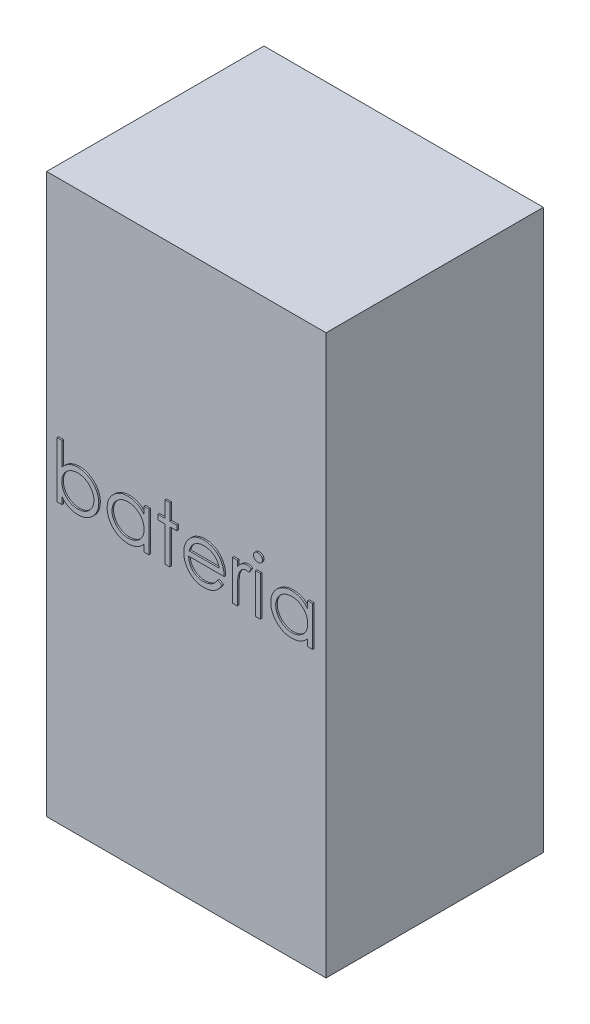
from build123d import *

# Parameters (mm, degrees)
SKETCH1_W           = 18
SKETCH1_H           = 36
BOSS_EXTRUDE1_DEPTH = 14
SKETCH2_W           = 0.314102565
SKETCH2_H           = 2.557692308
BOSS_EXTRUDE2_DEPTH = 0.1


with BuildPart() as part:
    # Sketch1 → Boss-Extrude1 (new body)
    with BuildSketch(Plane.XY):
        with Locations((9, -18)):
            Rectangle(SKETCH1_W, SKETCH1_H)
    extrude(amount=BOSS_EXTRUDE1_DEPTH)

    # Sketch2 → Boss-Extrude2 (add)
    # profile 1 of 8: a face of its own
    with BuildSketch(Plane.XY.offset(14)):
        with BuildLine():
            Line((0.766025641, -18), (0.766025641, -14.41025641))
            Line((0.766025641, -14.41025641), (1.080128205, -14.41025641))
            Line((1.080128205, -14.41025641), (1.080128205, -15.906450321))
            add(Edge.make_bspline(
                [(1.080128205, -15.906450321), (1.115521624, -15.865692389), (1.184575644, -15.786171983), (1.300352095, -15.682324334), (1.421757664, -15.594271856), (1.54971592, -15.521685738), (1.684408853, -15.466412131), (1.825140962, -15.425989741), (1.972272003, -15.401602838), (2.072591177, -15.398836765), (2.123397436, -15.397435897)],
                knots=[0, 0, 0, 0, 1.077089805, 2.101446609, 3.097517232, 4.067117542, 5.031729543, 5.997785507, 6.985986182, 8, 8, 8, 8], degree=3))
            add(Edge.make_bspline(
                [(2.123397436, -15.397435897), (2.168563574, -15.398676126), (2.257864726, -15.401128268), (2.389146873, -15.419762763), (2.515460148, -15.449980565), (2.636735796, -15.491872745), (2.752407928, -15.547455722), (2.863466985, -15.61399703), (2.96934397, -15.693235359), (3.068398855, -15.78383367), (3.159692742, -15.882190292), (3.239605252, -15.987370608), (3.307104948, -16.097845698), (3.36293624, -16.213245761), (3.406107293, -16.334042112), (3.435849561, -16.46011631), (3.454743025, -16.591344329), (3.457123271, -16.680657132), (3.458333333, -16.726061699)],
                knots=[0, 0, 0, 0, 1.034377878, 2.045141349, 3.03070803, 4.00595497, 4.978199603, 5.965204761, 6.967410914, 8.002051993, 9.036360596, 10.037508045, 11.022711142, 11.997267194, 12.969246472, 13.954813154, 14.960274251, 16, 16, 16, 16], degree=3))
            add(Edge.make_bspline(
                [(3.458333333, -16.726061699), (3.457096893, -16.770761716), (3.454658827, -16.858903112), (3.436037519, -16.988609668), (3.405291254, -17.113448367), (3.361330071, -17.233096624), (3.306065132, -17.348116538), (3.236953856, -17.457196942), (3.157142857, -17.562235918), (3.064811708, -17.659859549), (2.964898155, -17.750092949), (2.857983913, -17.828498814), (2.746761991, -17.896215934), (2.629498879, -17.949871382), (2.507930837, -17.993272303), (2.38075545, -18.023389994), (2.248692222, -18.040963049), (2.158973334, -18.043558616), (2.113581731, -18.044871795)],
                knots=[0, 0, 0, 0, 1.024244038, 2.01964794, 2.996620209, 3.965911562, 4.936179293, 5.91563013, 6.920572822, 7.955171681, 8.990768464, 10.002129126, 10.989675881, 11.969873457, 12.952483066, 13.943799762, 14.959703725, 16, 16, 16, 16], degree=3))
            add(Edge.make_bspline(
                [(2.113581731, -18.044871795), (2.061616619, -18.043431187), (1.959722094, -18.040606405), (1.810669429, -18.017187426), (1.669587879, -17.977325816), (1.534870331, -17.92376406), (1.408442608, -17.851235406), (1.289502026, -17.761278656), (1.178798653, -17.652411519), (1.113581838, -17.569350029), (1.080128205, -17.526742788)],
                knots=[0, 0, 0, 0, 1.035807596, 2.031038093, 2.998900396, 3.954262848, 4.914341711, 5.895762244, 6.92060972, 8, 8, 8, 8], degree=3))
            Line((1.080128205, -17.526742788), (1.080128205, -18))
            Line((1.080128205, -18), (0.766025641, -18))
        make_face()
        with BuildLine():
            add(Edge.make_bspline(
                [(2.110777244, -17.730769231), (2.156691596, -17.729135602), (2.247319225, -17.725911078), (2.380363015, -17.700737455), (2.507677225, -17.658853341), (2.628620307, -17.601569633), (2.741299619, -17.529547598), (2.841952253, -17.442401428), (2.931431963, -17.342899913), (3.006083739, -17.23066622), (3.068409983, -17.111215251), (3.111223259, -16.985560949), (3.139942981, -16.85706616), (3.142795279, -16.769920116), (3.144230769, -16.726061699)],
                knots=[0, 0, 0, 0, 1.031910345, 2.036826888, 3.032245421, 4.038315463, 5.03827337, 6.029480047, 7.023177075, 8.037597977, 9.052889626, 10.043399556, 11.015292101, 12, 12, 12, 12], degree=3))
            add(Edge.make_bspline(
                [(3.144230769, -16.726061699), (3.142343025, -16.682246157), (3.138575074, -16.594789996), (3.112200291, -16.465140329), (3.066142501, -16.339552704), (3.005024478, -16.218374716), (2.929156493, -16.105366915), (2.840150529, -16.003876788), (2.738268723, -15.916316804), (2.625445304, -15.843326733), (2.505265113, -15.78376718), (2.37877448, -15.742922154), (2.248616357, -15.716183967), (2.160220864, -15.713094838), (2.115685096, -15.711538462)],
                knots=[0, 0, 0, 0, 0.984795267, 1.965658976, 2.959410029, 3.983795688, 5.009594896, 6.01088574, 7.009236619, 8.019050059, 9.024672985, 10.014834719, 10.999826153, 12, 12, 12, 12], degree=3))
            add(Edge.make_bspline(
                [(2.115685096, -15.711538462), (2.070217589, -15.713093959), (1.979973812, -15.716181306), (1.84680559, -15.74296913), (1.716742306, -15.784016741), (1.592454774, -15.842948091), (1.476600719, -15.915059551), (1.372988107, -15.999799751), (1.283656549, -16.096579659), (1.210112778, -16.20508546), (1.151707979, -16.322270496), (1.109924231, -16.447282699), (1.084924585, -16.579464012), (1.081746452, -16.670097217), (1.080128205, -16.716245994)],
                knots=[0, 0, 0, 0, 1.016820015, 2.018181405, 3.029022337, 4.06341356, 5.088169224, 6.076823655, 7.05054209, 8.02560866, 9.001194327, 9.972267242, 10.967515442, 12, 12, 12, 12], degree=3))
            add(Edge.make_bspline(
                [(1.080128205, -16.716245994), (1.081087876, -16.751583812), (1.082976811, -16.821139821), (1.097407179, -16.923267512), (1.120362841, -17.021000604), (1.152706335, -17.1144456), (1.19520757, -17.20307204), (1.246417835, -17.28756812), (1.307369482, -17.367171398), (1.376276071, -17.441686718), (1.452238452, -17.509496133), (1.533761571, -17.568274358), (1.619179501, -17.618888548), (1.709469472, -17.65923339), (1.803580763, -17.692159911), (1.902479104, -17.713893657), (2.005150528, -17.728868696), (2.075197625, -17.730129049), (2.110777244, -17.730769231)],
                knots=[0, 0, 0, 0, 1.050331198, 2.067384183, 3.060053655, 4.031335885, 5.001026174, 5.976994447, 6.963687968, 7.976578778, 8.990422448, 9.985569286, 10.960374351, 11.936812464, 12.921228065, 13.919088064, 14.943024695, 16, 16, 16, 16], degree=3))
        make_face(mode=Mode.SUBTRACT)
    # profile 2 of 8: a face of its own
    with BuildSketch(Plane.XY.offset(14)):
        with BuildLine():
            Line((6.689102564, -15.442307692), (6.689102564, -18))
            Line((6.689102564, -18), (6.375, -18))
            Line((6.375, -18), (6.375, -17.557592147))
            add(Edge.make_bspline(
                [(6.375, -17.557592147), (6.339581209, -17.597631741), (6.270460994, -17.675769512), (6.155019876, -17.777851685), (6.032651698, -17.862230007), (5.903950377, -17.930379922), (5.769032134, -17.981571979), (5.628196046, -18.017958138), (5.481384666, -18.041351973), (5.381132311, -18.043687995), (5.330328526, -18.044871795)],
                knots=[0, 0, 0, 0, 1.074387032, 2.096679803, 3.090159297, 4.057316773, 5.018401886, 5.985159533, 6.978961417, 8, 8, 8, 8], degree=3))
            add(Edge.make_bspline(
                [(5.330328526, -18.044871795), (5.285160572, -18.043645423), (5.196087367, -18.041226962), (5.06505829, -18.022464659), (4.93896604, -17.992334037), (4.817691468, -17.950433147), (4.702019322, -17.894852326), (4.590959226, -17.828311078), (4.485086534, -17.749070248), (4.386014995, -17.658482219), (4.294782994, -17.560087232), (4.214721722, -17.455141685), (4.147968642, -17.344099381), (4.092148561, -17.228366227), (4.049152217, -17.107051308), (4.019178582, -16.98057414), (4.000438136, -16.849084266), (3.998020675, -16.759544743), (3.996794872, -16.714142628)],
                knots=[0, 0, 0, 0, 1.033919861, 2.038935746, 3.024066025, 3.998881131, 4.97069526, 5.957263378, 6.95902576, 7.993208707, 9.027059324, 10.027763471, 11.009749337, 11.988697705, 12.965288445, 13.950418724, 14.960734635, 16, 16, 16, 16], degree=3))
            add(Edge.make_bspline(
                [(3.996794872, -16.714142628), (3.998047843, -16.669678925), (4.0005249, -16.581776581), (4.01897812, -16.452497883), (4.050009129, -16.327979623), (4.093556976, -16.208622679), (4.149398931, -16.094282629), (4.217327018, -15.984878604), (4.297346143, -15.880109207), (4.38959855, -15.78243798), (4.48953332, -15.692217366), (4.596442051, -15.61380832), (4.707665332, -15.546091471), (4.824928343, -15.492437995), (4.946495448, -15.449028891), (5.073448893, -15.418995922), (5.205260472, -15.401298601), (5.294750964, -15.398735837), (5.340144231, -15.397435897)],
                knots=[0, 0, 0, 0, 1.020392517, 2.01726096, 2.990465484, 3.961182959, 4.928053699, 5.906110375, 6.912531644, 7.948652711, 8.985773172, 9.998621852, 10.987621588, 11.969261332, 12.953316658, 13.946091881, 14.958173133, 16, 16, 16, 16], degree=3))
            add(Edge.make_bspline(
                [(5.340144231, -15.397435897), (5.39234409, -15.398873649), (5.49470555, -15.401693012), (5.644433559, -15.425155739), (5.786078037, -15.464794206), (5.920732389, -15.518711704), (6.047913075, -15.590360433), (6.166416059, -15.680740394), (6.277481543, -15.789281581), (6.341861834, -15.872652026), (6.375, -15.915564904)],
                knots=[0, 0, 0, 0, 1.038897134, 2.037228247, 3.008116434, 3.962042015, 4.918381754, 5.904844433, 6.921570401, 8, 8, 8, 8], degree=3))
            Line((6.375, -15.915564904), (6.375, -15.442307692))
            Line((6.375, -15.442307692), (6.689102564, -15.442307692))
        make_face()
        with BuildLine():
            add(Edge.make_bspline(
                [(5.344350962, -15.711538462), (5.298436624, -15.713172099), (5.207809024, -15.71639664), (5.074765022, -15.741570135), (4.947451608, -15.78345473), (4.826505533, -15.840736631), (4.713837317, -15.912765368), (4.613143646, -15.999886751), (4.523600944, -16.099723765), (4.44829268, -16.211825875), (4.386902183, -16.332003967), (4.343735151, -16.457628405), (4.315265904, -16.586433382), (4.312357383, -16.673796068), (4.310897436, -16.717648237)],
                knots=[0, 0, 0, 0, 1.031046209, 2.035121221, 3.029706178, 4.034933723, 5.034054252, 6.02443088, 7.017295772, 8.038157696, 9.050218397, 10.03989886, 11.016116709, 12, 12, 12, 12], degree=3))
            add(Edge.make_bspline(
                [(4.310897436, -16.717648237), (4.312762329, -16.761238344), (4.316484806, -16.8482477), (4.3432355, -16.977228277), (4.388115374, -17.102882319), (4.449357437, -17.224143313), (4.526044061, -17.336727413), (4.614932714, -17.438467536), (4.716882995, -17.525957124), (4.829810502, -17.599194697), (4.950418473, -17.658357218), (5.077252404, -17.699522858), (5.207928042, -17.726100638), (5.296780376, -17.729205115), (5.341546474, -17.730769231)],
                knots=[0, 0, 0, 0, 0.979072187, 1.954306742, 2.945804271, 3.96968567, 4.997920485, 5.998718438, 6.996577872, 8.005894225, 9.015743152, 10.005417472, 10.995077863, 12, 12, 12, 12], degree=3))
            add(Edge.make_bspline(
                [(5.341546474, -17.730769231), (5.386992977, -17.729109267), (5.477381564, -17.725807763), (5.610820272, -17.700526498), (5.740315234, -17.6587577), (5.864102463, -17.600858573), (5.979418594, -17.529101217), (6.082916471, -17.445094126), (6.17043244, -17.347390942), (6.244625049, -17.240014489), (6.302800466, -17.122302492), (6.345176525, -16.996968302), (6.370230431, -16.864007553), (6.373388161, -16.773143626), (6.375, -16.726762821)],
                knots=[0, 0, 0, 0, 1.01762866, 2.023962475, 3.030623092, 4.058876274, 5.077231937, 6.066672613, 7.034107872, 8.005628644, 8.981990164, 9.965428785, 10.961468474, 12, 12, 12, 12], degree=3))
            add(Edge.make_bspline(
                [(6.375, -16.726762821), (6.374040344, -16.69142499), (6.372151436, -16.621868957), (6.357720867, -16.519741439), (6.33476594, -16.422007713), (6.30241977, -16.328565024), (6.259928486, -16.239930009), (6.20868072, -16.155466248), (6.14777527, -16.075613037), (6.078192574, -16.001469966), (6.002027372, -15.933843504), (5.921432831, -15.873479263), (5.835454084, -15.82389049), (5.745537047, -15.782849219), (5.651525713, -15.750190069), (5.552655093, -15.728402375), (5.449976106, -15.713442054), (5.37993005, -15.712179673), (5.344350962, -15.711538462)],
                knots=[0, 0, 0, 0, 1.050140795, 2.067009409, 3.05949893, 4.030605086, 5.00011959, 5.97591094, 6.962425594, 7.979863591, 8.993523472, 9.986985069, 10.967611495, 11.937549037, 12.921786183, 13.919465291, 14.943216303, 16, 16, 16, 16], degree=3))
        make_face(mode=Mode.SUBTRACT)
    # profile 3 of 8: a face of its own
    with BuildSketch(Plane.XY.offset(14)):
        Polygon((7.721153846, -14.41025641), (8.03525641, -14.41025641), (8.03525641, -15.442307692), (8.483974359, -15.442307692), (8.483974359, -15.756410256), (8.03525641, -15.756410256), (8.03525641, -18), (7.721153846, -18), (7.721153846, -15.756410256), (7.272435897, -15.756410256), (7.272435897, -15.442307692), (7.721153846, -15.442307692), align=None)
    # profile 4 of 8: a face of its own
    with BuildSketch(Plane.XY.offset(14)):
        with BuildLine():
            Line((11.121594551, -17.192307692), (11.400641026, -17.338842147))
            add(Edge.make_bspline(
                [(11.400641026, -17.338842147), (11.37840443, -17.378285479), (11.335140822, -17.455026582), (11.260740074, -17.560458442), (11.182748001, -17.655306158), (11.097644033, -17.737035812), (11.007974354, -17.808287197), (10.9132417, -17.870625022), (10.812952882, -17.923743542), (10.707103157, -17.96849607), (10.594803606, -18.002905564), (10.47578209, -18.027209785), (10.349810594, -18.042233054), (10.263464414, -18.043978194), (10.219250801, -18.044871795)],
                knots=[0, 0, 0, 0, 1.120438281, 2.179929193, 3.190490725, 4.156257408, 5.095198341, 6.022838206, 6.959905092, 7.901321166, 8.864066838, 9.862729781, 10.905609505, 12, 12, 12, 12], degree=3))
            add(Edge.make_bspline(
                [(10.219250801, -18.044871795), (10.170108824, -18.04372462), (10.074247062, -18.041486813), (9.934707315, -18.022194348), (9.803327897, -17.99072199), (9.680116193, -17.946756448), (9.565373941, -17.889329124), (9.458873086, -17.819369642), (9.36005356, -17.737237388), (9.272029351, -17.642220944), (9.192785468, -17.540538987), (9.122859648, -17.434583102), (9.064402217, -17.324619878), (9.016849607, -17.211349354), (8.978444742, -17.09548546), (8.951678038, -16.975973993), (8.93624829, -16.853138408), (8.933883845, -16.770041073), (8.932692308, -16.728165064)],
                knots=[0, 0, 0, 0, 1.145258523, 2.234067595, 3.276747158, 4.290159414, 5.277019952, 6.260822364, 7.254936242, 8.264827045, 9.274100331, 10.257902744, 11.220704747, 12.172965371, 13.118907548, 14.062713208, 15.023725156, 16, 16, 16, 16], degree=3))
            add(Edge.make_bspline(
                [(8.932692308, -16.728165064), (8.933751449, -16.688870234), (8.935850527, -16.610993069), (8.949081315, -16.495727524), (8.972529608, -16.383699072), (9.004705932, -16.274814624), (9.046257178, -16.16925649), (9.097089397, -16.066960426), (9.157281775, -15.968035287), (9.203754449, -15.905632153), (9.227163462, -15.874198718)],
                knots=[0, 0, 0, 0, 1.024358464, 2.0301432, 3.019427413, 4.004406732, 4.986367066, 5.972626655, 6.978780325, 8, 8, 8, 8], degree=3))
            add(Edge.make_bspline(
                [(9.227163462, -15.874198718), (9.258871144, -15.836329848), (9.321282091, -15.761791697), (9.426838446, -15.663853372), (9.541138643, -15.581809596), (9.662750269, -15.51380246), (9.793086743, -15.462128813), (9.930396034, -15.423621231), (10.07624162, -15.40204322), (10.175946841, -15.398995386), (10.226963141, -15.397435897)],
                knots=[0, 0, 0, 0, 1.030682036, 2.02871468, 2.997146059, 3.962720338, 4.930598197, 5.918074684, 6.934738563, 8, 8, 8, 8], degree=3))
            add(Edge.make_bspline(
                [(10.226963141, -15.397435897), (10.279410746, -15.398789946), (10.382300992, -15.401446282), (10.532333113, -15.426072615), (10.67429383, -15.46512517), (10.808126334, -15.52027896), (10.933844195, -15.591438512), (11.050630244, -15.679580353), (11.160481757, -15.781998441), (11.224390336, -15.86076165), (11.256911058, -15.900841346)],
                knots=[0, 0, 0, 0, 1.056321875, 2.072262726, 3.055038591, 4.01806755, 4.982017516, 5.957941055, 6.960871419, 8, 8, 8, 8], degree=3))
            add(Edge.make_bspline(
                [(11.256911058, -15.900841346), (11.279037996, -15.931044928), (11.323144589, -15.991251046), (11.378391689, -16.089422203), (11.426349084, -16.192132798), (11.464682045, -16.301043095), (11.495721546, -16.414862675), (11.518178365, -16.53440522), (11.531347984, -16.659635131), (11.533936681, -16.744961686), (11.53525641, -16.788461538)],
                knots=[0, 0, 0, 0, 0.94817472, 1.890038105, 2.849395472, 3.817997239, 4.812318967, 5.836947057, 6.897266129, 8, 8, 8, 8], degree=3))
            Line((11.53525641, -16.788461538), (9.246794872, -16.788461538))
            add(Edge.make_bspline(
                [(9.246794872, -16.788461538), (9.248334478, -16.822162003), (9.251362052, -16.888432606), (9.265477195, -16.98540339), (9.287725969, -17.077776732), (9.318995032, -17.164859774), (9.356861877, -17.247789901), (9.403247594, -17.325951938), (9.458587148, -17.398989868), (9.520312847, -17.467557006), (9.589019942, -17.528617767), (9.66130269, -17.583269543), (9.738196255, -17.62907514), (9.819094338, -17.66625503), (9.903866123, -17.695361346), (9.992538318, -17.715229166), (10.084936435, -17.728536273), (10.147922169, -17.730015939), (10.179987981, -17.730769231)],
                knots=[0, 0, 0, 0, 1.094153842, 2.151609401, 3.174256925, 4.172055639, 5.149267565, 6.128595816, 7.11444997, 8.118368179, 9.117203808, 10.09244225, 11.054858984, 12.015122123, 12.976791628, 13.957293641, 14.960065497, 16, 16, 16, 16], degree=3))
            add(Edge.make_bspline(
                [(10.179987981, -17.730769231), (10.211339128, -17.730161174), (10.273545819, -17.728954673), (10.366186677, -17.717222762), (10.457326204, -17.698252487), (10.546587187, -17.672362496), (10.632158033, -17.640785644), (10.711403583, -17.602682787), (10.784283799, -17.56053304), (10.852400766, -17.512323365), (10.918471759, -17.453315178), (10.984014245, -17.379679457), (11.054290899, -17.292591929), (11.098280491, -17.227046263), (11.121594551, -17.192307692)],
                knots=[0, 0, 0, 0, 0.99110716, 1.966546729, 2.947904876, 3.932708344, 4.903319531, 5.828989031, 6.710028674, 7.56322171, 8.463672341, 9.504779593, 10.677557249, 12, 12, 12, 12], degree=3))
        make_face()
        with BuildLine():
            add(Edge.make_bspline(
                [(11.221153846, -16.474358974), (11.209657222, -16.432696101), (11.18752992, -16.35250848), (11.141293556, -16.24146759), (11.089222015, -16.142779689), (11.027600284, -16.057200056), (10.957781558, -15.981196543), (10.877136375, -15.914777957), (10.786700482, -15.855360506), (10.686941341, -15.805208007), (10.581299556, -15.762518148), (10.470693364, -15.733893032), (10.357835576, -15.71428349), (10.28150129, -15.712457382), (10.243088942, -15.711538462)],
                knots=[0, 0, 0, 0, 1.154881502, 2.222775134, 3.210006277, 4.132804581, 5.035138423, 5.962687519, 6.919655026, 7.923214229, 8.944639381, 9.960483929, 10.97369054, 12, 12, 12, 12], degree=3))
            add(Edge.make_bspline(
                [(10.243088942, -15.711538462), (10.211739504, -15.712150133), (10.149768255, -15.713359279), (10.058467187, -15.724829408), (9.970787488, -15.743789253), (9.8860822, -15.76975421), (9.805461332, -15.804362812), (9.727266563, -15.844946039), (9.653486167, -15.894487623), (9.607344872, -15.932246478), (9.584034455, -15.951322115)],
                knots=[0, 0, 0, 0, 1.04873581, 2.073130211, 3.073294108, 4.04793562, 5.032784715, 6.005352987, 6.992311501, 8, 8, 8, 8], degree=3))
            add(Edge.make_bspline(
                [(9.584034455, -15.951322115), (9.567341173, -15.966416431), (9.533558039, -15.996963647), (9.488417517, -16.049592854), (9.445197045, -16.106344416), (9.405863392, -16.16938954), (9.369785806, -16.238010319), (9.336025828, -16.311627955), (9.305639416, -16.390801085), (9.288543306, -16.445973524), (9.279747596, -16.474358974)],
                knots=[0, 0, 0, 0, 0.879870761, 1.780643979, 2.707998968, 3.669668524, 4.684282772, 5.740141944, 6.837334558, 8, 8, 8, 8], degree=3))
            Line((9.279747596, -16.474358974), (11.221153846, -16.474358974))
        make_face(mode=Mode.SUBTRACT)
    # profile 5 of 8: a face of its own
    with BuildSketch(Plane.XY.offset(14)):
        with BuildLine():
            Line((12.073717949, -15.442307692), (12.387820513, -15.442307692))
            Line((12.387820513, -15.442307692), (12.387820513, -15.818810096))
            add(Edge.make_bspline(
                [(12.387820513, -15.818810096), (12.411009272, -15.783754268), (12.455357593, -15.716710269), (12.529070522, -15.628040968), (12.604573853, -15.554625921), (12.68222904, -15.496122402), (12.76260714, -15.452309283), (12.843944092, -15.420216248), (12.927519562, -15.401238933), (12.983681486, -15.398705274), (13.01181891, -15.397435897)],
                knots=[0, 0, 0, 0, 1.2804753, 2.448899062, 3.506932113, 4.484331642, 5.4025378, 6.288909075, 7.142734305, 8, 8, 8, 8], degree=3))
            add(Edge.make_bspline(
                [(13.01181891, -15.397435897), (13.033645237, -15.398626424), (13.078554322, -15.40107601), (13.146536912, -15.418286835), (13.216580364, -15.445764857), (13.261722751, -15.47160508), (13.28525641, -15.485076122)],
                knots=[0, 0, 0, 0, 0.901110191, 1.854092781, 2.881294221, 4, 4, 4, 4], degree=3))
            Line((13.28525641, -15.485076122), (13.112780449, -15.757111378))
            add(Edge.make_bspline(
                [(13.112780449, -15.757111378), (13.097671428, -15.750371112), (13.068991613, -15.737576797), (13.027037047, -15.722434787), (12.98835571, -15.713518871), (12.963712152, -15.712168153), (12.952223558, -15.711538462)],
                knots=[0, 0, 0, 0, 1.180555205, 2.24091978, 3.179933427, 4, 4, 4, 4], degree=3))
            add(Edge.make_bspline(
                [(12.952223558, -15.711538462), (12.927017824, -15.713218499), (12.875605434, -15.716645288), (12.800120935, -15.743584096), (12.726873729, -15.787109336), (12.668702067, -15.835380448), (12.623659814, -15.881928245), (12.591519589, -15.922576648), (12.562036842, -15.968155279), (12.533866621, -16.017884963), (12.508200327, -16.072614809), (12.484245658, -16.131798023), (12.462586795, -16.195503151), (12.450236551, -16.239885672), (12.443910256, -16.262620192)],
                knots=[0, 0, 0, 0, 1.125678352, 2.296057538, 3.5422874, 4.923748041, 5.663163013, 6.437101912, 7.23742474, 8.08941207, 8.991984279, 9.93940061, 10.944477711, 12, 12, 12, 12], degree=3))
            add(Edge.make_bspline(
                [(12.443910256, -16.262620192), (12.439177863, -16.282897366), (12.428695971, -16.327809765), (12.418504434, -16.403158289), (12.408434916, -16.492181948), (12.401338297, -16.595128541), (12.394760255, -16.711740985), (12.391050173, -16.84219693), (12.387947032, -16.986630282), (12.387863965, -17.087604635), (12.387820513, -17.140424679)],
                knots=[0, 0, 0, 0, 0.566838948, 1.255505196, 2.06880316, 3.007127437, 4.065329342, 5.249902469, 6.561414163, 8, 8, 8, 8], degree=3))
            Line((12.387820513, -17.140424679), (12.387820513, -18))
            Line((12.387820513, -18), (12.073717949, -18))
            Line((12.073717949, -18), (12.073717949, -15.442307692))
        make_face()
    # profile 6 of 8: a face of its own
    with BuildSketch(Plane.XY.offset(14)):
        with BuildLine():
            add(Edge.make_bspline(
                [(13.710136218, -14.365384615), (13.729627534, -14.366288768), (13.767795274, -14.368059272), (13.822988541, -14.383220749), (13.873245553, -14.408920434), (13.917823286, -14.443400115), (13.956075173, -14.483949559), (13.982855883, -14.531210527), (14.000068279, -14.582269166), (14.002146835, -14.617884255), (14.003205128, -14.636017628)],
                knots=[0, 0, 0, 0, 1.055194115, 2.066272739, 3.074728998, 4.095836921, 5.109056067, 6.073838105, 7.019297344, 8, 8, 8, 8], degree=3))
            add(Edge.make_bspline(
                [(14.003205128, -14.636017628), (14.002122968, -14.653680281), (13.999983666, -14.688597256), (13.982869178, -14.738770728), (13.95584694, -14.785375012), (13.917847815, -14.825845722), (13.873239054, -14.860306342), (13.822990268, -14.886011081), (13.767794819, -14.901171218), (13.72962738, -14.902941907), (13.710136218, -14.903846154)],
                knots=[0, 0, 0, 0, 0.96129708, 1.900370562, 2.859976407, 3.87933698, 4.906634145, 5.921202961, 6.938410037, 8, 8, 8, 8], degree=3))
            add(Edge.make_bspline(
                [(13.710136218, -14.903846154), (13.690867943, -14.902976434), (13.653364763, -14.901283637), (13.59899792, -14.885713619), (13.549169431, -14.860297546), (13.504504758, -14.826071361), (13.467274565, -14.785126464), (13.44017624, -14.73879917), (13.423101278, -14.688590015), (13.420956649, -14.653677849), (13.419871795, -14.636017628)],
                knots=[0, 0, 0, 0, 1.054934014, 2.053291228, 3.073705704, 4.106921865, 5.123545215, 6.088680038, 7.033164197, 8, 8, 8, 8], degree=3))
            add(Edge.make_bspline(
                [(13.419871795, -14.636017628), (13.420932881, -14.617886779), (13.423016923, -14.582276646), (13.440189039, -14.531181613), (13.467048846, -14.484200111), (13.50452941, -14.443174612), (13.54916287, -14.408929177), (13.598999615, -14.383518196), (13.653364315, -14.367946856), (13.690867791, -14.366254242), (13.710136218, -14.365384615)],
                knots=[0, 0, 0, 0, 0.98631895, 1.937192651, 2.907499808, 3.917963147, 4.944918757, 5.95915025, 6.951458133, 8, 8, 8, 8], degree=3))
        make_face()
    # profile 7 of 8: a face of its own
    with BuildSketch(Plane.XY.offset(14)):
        with Locations((13.711538462, -16.721153846)):
            Rectangle(SKETCH2_W, SKETCH2_H)
    # profile 8 of 8: a face of its own
    with BuildSketch(Plane.XY.offset(14)):
        with BuildLine():
            Line((17.233974359, -15.442307692), (17.233974359, -18))
            Line((17.233974359, -18), (16.919871795, -18))
            Line((16.919871795, -18), (16.919871795, -17.557592147))
            add(Edge.make_bspline(
                [(16.919871795, -17.557592147), (16.884453004, -17.597631741), (16.815332789, -17.675769512), (16.699891671, -17.777851685), (16.577523493, -17.862230007), (16.448822172, -17.930379922), (16.313903929, -17.981571979), (16.173067841, -18.017958138), (16.02625646, -18.041351973), (15.926004106, -18.043687995), (15.875200321, -18.044871795)],
                knots=[0, 0, 0, 0, 1.074387032, 2.096679803, 3.090159297, 4.057316773, 5.018401886, 5.985159533, 6.978961417, 8, 8, 8, 8], degree=3))
            add(Edge.make_bspline(
                [(15.875200321, -18.044871795), (15.830032367, -18.043645423), (15.740959162, -18.041226962), (15.609930085, -18.022464659), (15.483837835, -17.992334037), (15.362563263, -17.950433147), (15.246891117, -17.894852326), (15.13583102, -17.828311078), (15.029958328, -17.749070248), (14.930886789, -17.658482219), (14.839654789, -17.560087232), (14.759593516, -17.455141685), (14.692840437, -17.344099381), (14.637020356, -17.228366227), (14.594024011, -17.107051308), (14.564050377, -16.98057414), (14.54530993, -16.849084266), (14.54289247, -16.759544743), (14.541666667, -16.714142628)],
                knots=[0, 0, 0, 0, 1.033919861, 2.038935746, 3.024066025, 3.998881131, 4.97069526, 5.957263378, 6.95902576, 7.993208707, 9.027059324, 10.027763471, 11.009749337, 11.988697705, 12.965288445, 13.950418724, 14.960734635, 16, 16, 16, 16], degree=3))
            add(Edge.make_bspline(
                [(14.541666667, -16.714142628), (14.542919638, -16.669678925), (14.545396695, -16.581776581), (14.563849915, -16.452497883), (14.594880923, -16.327979623), (14.638428771, -16.208622679), (14.694270726, -16.094282629), (14.762198813, -15.984878604), (14.842217938, -15.880109207), (14.934470345, -15.78243798), (15.034405115, -15.692217366), (15.141313846, -15.61380832), (15.252537127, -15.546091471), (15.369800138, -15.492437995), (15.491367242, -15.449028891), (15.618320688, -15.418995922), (15.750132267, -15.401298601), (15.839622759, -15.398735837), (15.885016026, -15.397435897)],
                knots=[0, 0, 0, 0, 1.020392517, 2.01726096, 2.990465484, 3.961182959, 4.928053699, 5.906110375, 6.912531644, 7.948652711, 8.985773172, 9.998621852, 10.987621588, 11.969261332, 12.953316658, 13.946091881, 14.958173133, 16, 16, 16, 16], degree=3))
            add(Edge.make_bspline(
                [(15.885016026, -15.397435897), (15.937215885, -15.398873649), (16.039577345, -15.401693012), (16.189305354, -15.425155739), (16.330949832, -15.464794206), (16.465604184, -15.518711704), (16.59278487, -15.590360433), (16.711287854, -15.680740394), (16.822353338, -15.789281581), (16.886733629, -15.872652026), (16.919871795, -15.915564904)],
                knots=[0, 0, 0, 0, 1.038897134, 2.037228247, 3.008116434, 3.962042015, 4.918381754, 5.904844433, 6.921570401, 8, 8, 8, 8], degree=3))
            Line((16.919871795, -15.915564904), (16.919871795, -15.442307692))
            Line((16.919871795, -15.442307692), (17.233974359, -15.442307692))
        make_face()
        with BuildLine():
            add(Edge.make_bspline(
                [(15.889222756, -15.711538462), (15.843308419, -15.713172099), (15.752680819, -15.71639664), (15.619636817, -15.741570135), (15.492323402, -15.78345473), (15.371377328, -15.840736631), (15.258709112, -15.912765368), (15.158015441, -15.999886751), (15.068472739, -16.099723765), (14.993164475, -16.211825875), (14.931773978, -16.332003967), (14.888606946, -16.457628405), (14.860137699, -16.586433382), (14.857229178, -16.673796068), (14.855769231, -16.717648237)],
                knots=[0, 0, 0, 0, 1.031046209, 2.035121221, 3.029706178, 4.034933723, 5.034054252, 6.02443088, 7.017295772, 8.038157696, 9.050218397, 10.03989886, 11.016116709, 12, 12, 12, 12], degree=3))
            add(Edge.make_bspline(
                [(14.855769231, -16.717648237), (14.857634124, -16.761238344), (14.861356601, -16.8482477), (14.888107295, -16.977228277), (14.932987169, -17.102882319), (14.994229232, -17.224143313), (15.070915856, -17.336727413), (15.159804509, -17.438467536), (15.26175479, -17.525957124), (15.374682297, -17.599194697), (15.495290268, -17.658357218), (15.622124199, -17.699522858), (15.752799837, -17.726100638), (15.841652171, -17.729205115), (15.886418269, -17.730769231)],
                knots=[0, 0, 0, 0, 0.979072187, 1.954306742, 2.945804271, 3.96968567, 4.997920485, 5.998718438, 6.996577872, 8.005894225, 9.015743152, 10.005417472, 10.995077863, 12, 12, 12, 12], degree=3))
            add(Edge.make_bspline(
                [(15.886418269, -17.730769231), (15.931864772, -17.729109267), (16.022253359, -17.725807763), (16.155692066, -17.700526498), (16.285187029, -17.6587577), (16.408974258, -17.600858573), (16.524290389, -17.529101217), (16.627788266, -17.445094126), (16.715304235, -17.347390942), (16.789496844, -17.240014489), (16.847672261, -17.122302492), (16.89004832, -16.996968302), (16.915102226, -16.864007553), (16.918259956, -16.773143626), (16.919871795, -16.726762821)],
                knots=[0, 0, 0, 0, 1.01762866, 2.023962475, 3.030623092, 4.058876274, 5.077231937, 6.066672613, 7.034107872, 8.005628644, 8.981990164, 9.965428785, 10.961468474, 12, 12, 12, 12], degree=3))
            add(Edge.make_bspline(
                [(16.919871795, -16.726762821), (16.918912139, -16.69142499), (16.917023231, -16.621868957), (16.902592662, -16.519741439), (16.879637735, -16.422007713), (16.847291565, -16.328565024), (16.804800281, -16.239930009), (16.753552515, -16.155466248), (16.692647065, -16.075613037), (16.623064369, -16.001469966), (16.546899166, -15.933843504), (16.466304626, -15.873479263), (16.380325879, -15.82389049), (16.290408842, -15.782849219), (16.196397507, -15.750190069), (16.097526888, -15.728402375), (15.994847901, -15.713442054), (15.924801845, -15.712179673), (15.889222756, -15.711538462)],
                knots=[0, 0, 0, 0, 1.050140795, 2.067009409, 3.05949893, 4.030605086, 5.00011959, 5.97591094, 6.962425594, 7.979863591, 8.993523472, 9.986985069, 10.967611495, 11.937549037, 12.921786183, 13.919465291, 14.943216303, 16, 16, 16, 16], degree=3))
        make_face(mode=Mode.SUBTRACT)
    extrude(amount=BOSS_EXTRUDE2_DEPTH)


solid = part.part
